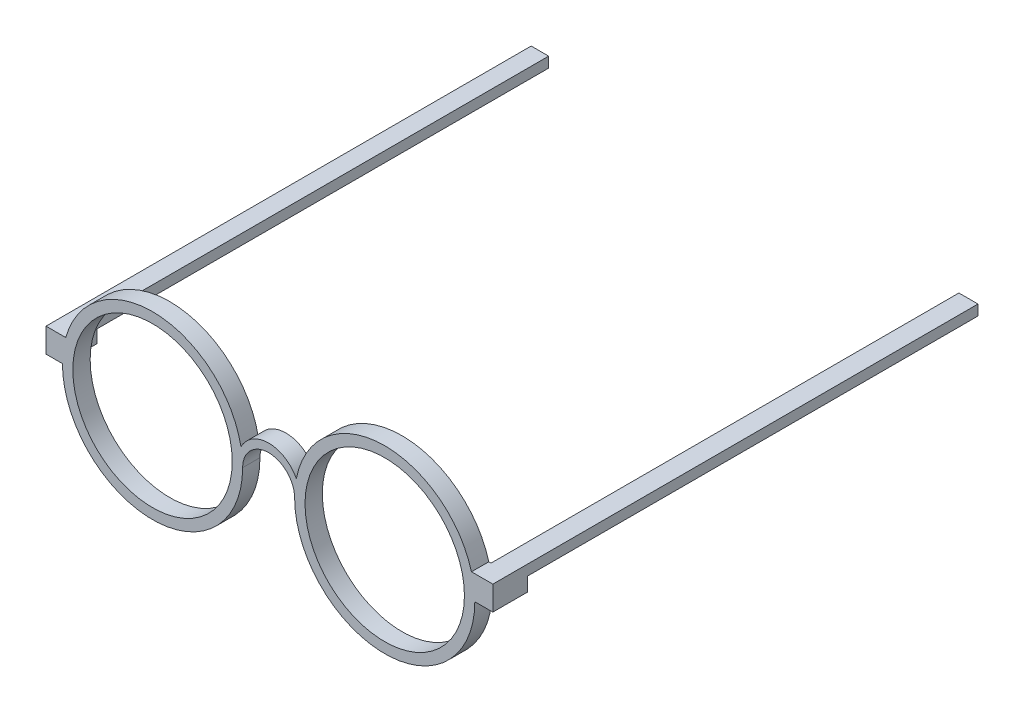
from build123d import *

# Parameters (mm, degrees)
SKIZZE1_R                       = 23
AUFSATZ_LINEAR_AUSTRAGEN1_DEPTH = 5
SKIZZE2_W                       = 5.200502725
SKIZZE2_H                       = 4
SKIZZE2_W_2                     = 4.740793673
AUFSATZ_LINEAR_AUSTRAGEN2_DEPTH = 5
SKIZZE3_W                       = 5.510037568
SKIZZE3_H                       = 140
SKIZZE3_W_2                     = 5.050328516
AUFSATZ_LINEAR_AUSTRAGEN3_DEPTH = 3
SKIZZE4_W                       = 5
SKIZZE4_H                       = 3
AUFSATZ_LINEAR_AUSTRAGEN4_DEPTH = 3
SKIZZE5_W                       = 5
SKIZZE5_H                       = 3
AUFSATZ_LINEAR_AUSTRAGEN5_DEPTH = 3


with BuildPart() as part:
    # Skizze1 → Aufsatz-Linear austragen1 (new body)
    with BuildSketch(Plane.XY):
        with BuildLine():
            Line((64.700502725, 4), (59.190465157, 4))
            ThreePointArc((59.190465157, 4), (34.007664459, 25.995043312), (7.985298356, 5))
            ThreePointArc((7.985298356, 5), (-0.004875067, 9.908732253), (-7.980769231, 4.976832421))
            ThreePointArc((-7.980769231, 4.976832421), (-33.995863589, 25.995271095), (-59.190465157, 4))
            Line((-59.190465157, 4), (-64.240793673, 4))
            Line((-64.240793673, 4), (-64.240793673, 0))
            Line((-64.240793673, 0), (-59.5, 0))
            ThreePointArc((-59.5, 0), (-33.5, -26), (-7.5, 0))
            ThreePointArc((-7.5, 0), (0, 7.5), (7.5, 0))
            ThreePointArc((7.5, 0), (33.5, -26), (59.5, 0))
            Line((59.5, 0), (64.700502725, 0))
            Line((64.700502725, 0), (64.700502725, 4))
        make_face()
        with Locations((33.5, 0)):
            Circle(SKIZZE1_R, mode=Mode.SUBTRACT)
        with Locations((-33.5, 0)):
            Circle(SKIZZE1_R, mode=Mode.SUBTRACT)
    extrude(amount=AUFSATZ_LINEAR_AUSTRAGEN1_DEPTH)

    # Skizze2 → Aufsatz-Linear austragen2 (add)
    with BuildSketch(Plane(origin=(0, 0, 0), x_dir=(-1, 0, 0), z_dir=(0, 0, -1))):
        with Locations((-62.100251363, 2)):
            Rectangle(SKIZZE2_W, SKIZZE2_H)
        with Locations((61.870396837, 2)):
            Rectangle(SKIZZE2_W_2, SKIZZE2_H)
    extrude(amount=AUFSATZ_LINEAR_AUSTRAGEN2_DEPTH)

    # Skizze3 → Aufsatz-Linear austragen3 (add)
    with BuildSketch(Plane(origin=(0, 4, 0), x_dir=(1, 0, 0), z_dir=(0, 1, 0))):
        with Locations((61.945483941, 65)):
            Rectangle(SKIZZE3_W, SKIZZE3_H)
        with Locations((-61.715629415, 65)):
            Rectangle(SKIZZE3_W_2, SKIZZE3_H)
    extrude(amount=AUFSATZ_LINEAR_AUSTRAGEN3_DEPTH)

    # Skizze4 → Aufsatz-Linear austragen4 (add)
    with BuildSketch(Plane.ZY.offset(-59.190465157)):
        with Locations((2.5, 5.5)):
            Rectangle(SKIZZE4_W, SKIZZE4_H)
    extrude(amount=AUFSATZ_LINEAR_AUSTRAGEN4_DEPTH)

    # Skizze5 → Aufsatz-Linear austragen5 (add)
    with BuildSketch(Plane(origin=(-59.190465157, 0, 0), x_dir=(0, 0, -1), z_dir=(1, 0, 0))):
        with Locations((-2.5, 5.5)):
            Rectangle(SKIZZE5_W, SKIZZE5_H)
    extrude(amount=AUFSATZ_LINEAR_AUSTRAGEN5_DEPTH)


solid = part.part
